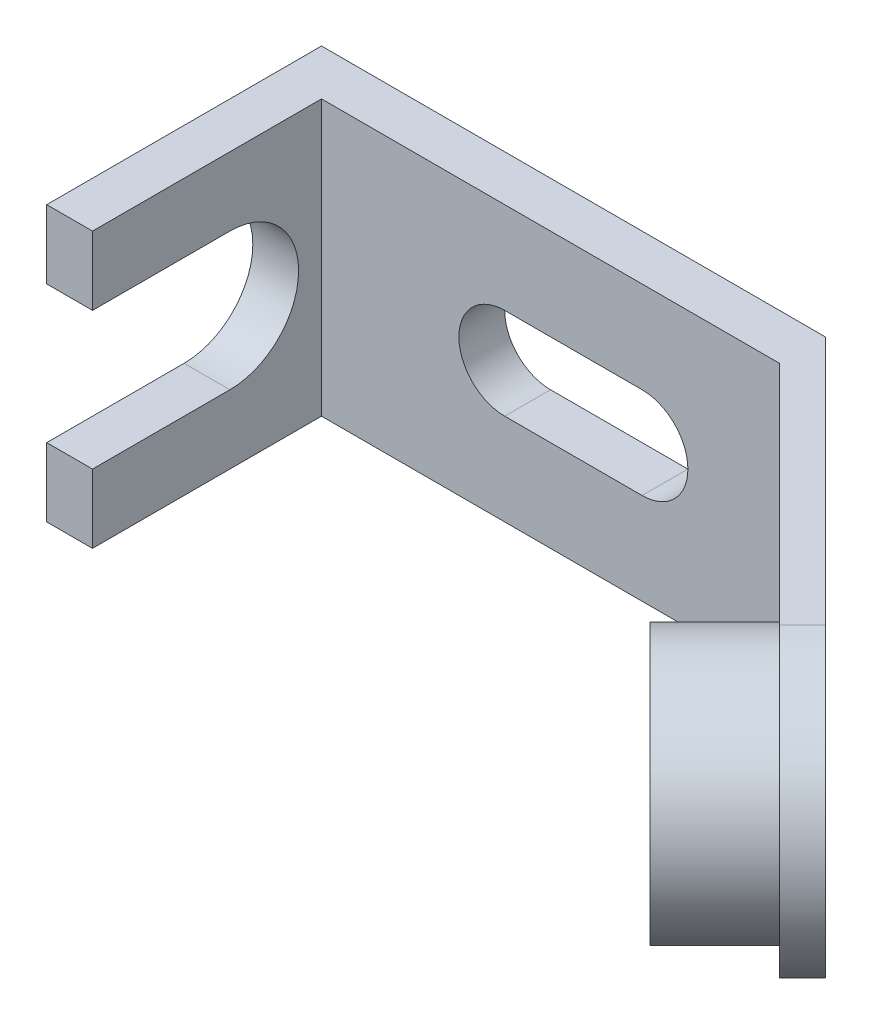
from build123d import *

# Parameters (mm, degrees)
SKETCH1_W           = 100
SKETCH1_H           = 60
BOSS_EXTRUDE1_DEPTH = 10
BOSS_EXTRUDE2_DEPTH = 10
BOSS_EXTRUDE3_DEPTH = 60
SKETCH5_R           = 25
SKETCH5_R_2         = 15
BOSS_EXTRUDE4_DEPTH = 20
CUT_EXTRUDE3_DEPTH  = 20
CUT_EXTRUDE4_START  = -20
SKETCH6_R           = 15
CUT_EXTRUDE4_DEPTH  = 20


with BuildPart() as part:
    # Sketch1 → Boss-Extrude1 (new body)
    with BuildSketch(Plane.XY):
        Rectangle(SKETCH1_W, SKETCH1_H)
        with BuildLine():
            Line((-10, 10), (20, 10))
            ThreePointArc((20, 10), (30, 0), (20, -10))
            Line((20, -10), (-10, -10))
            ThreePointArc((-10, -10), (-20, 0), (-10, 10))
        make_face(mode=Mode.SUBTRACT)
    extrude(amount=BOSS_EXTRUDE1_DEPTH)

    # Sketch3 → Boss-Extrude2 (add)
    with BuildSketch(Plane.ZY.offset(50)):
        with BuildLine():
            Line((0, 30), (60, 30))
            Line((60, 30), (60, 15))
            Line((60, 15), (30, 15))
            ThreePointArc((30, 15), (15, 0), (30, -15))
            Line((30, -15), (60, -15))
            Line((60, -15), (60, -30))
            Line((60, -30), (0, -30))
            Line((0, -30), (0, 30))
        make_face()
    extrude(amount=BOSS_EXTRUDE2_DEPTH)

    # Sketch4 → Boss-Extrude3 (add)
    with BuildSketch(Plane.XZ.offset(30)):
        Polygon((50, 10), (125, 85), (130, 80), (50, 0), align=None)
    extrude(amount=-BOSS_EXTRUDE3_DEPTH)

    # Sketch5 → Boss-Extrude4 (add)
    with BuildSketch(Plane(origin=(20, 0, -20), x_dir=(0.7071067811865462, 0, 0.7071067811865488), z_dir=(-0.7071067811865488, 0, 0.7071067811865462))):
        with Locations((112.426406871, 0)):
            Circle(SKETCH5_R)
        with Locations((112.426406871, 0)):
            Circle(SKETCH5_R_2, mode=Mode.SUBTRACT)
    extrude(amount=BOSS_EXTRUDE4_DEPTH)

    # Sketch5<4> → Cut-Extrude3 (cut)
    with BuildSketch(Plane(origin=(20, 0, -20), x_dir=(0.7071067811865462, 0, 0.7071067811865488), z_dir=(-0.7071067811865488, 0, 0.7071067811865462))):
        with BuildLine():
            Line((112.426406871, -30), (148.492424049, -30))
            Line((148.492424049, -30), (148.492424049, 30))
            Line((148.492424049, 30), (112.426406871, 30))
            ThreePointArc((112.426406871, 30), (142.426406871, 0), (112.426406871, -30))
        make_face()
    extrude(amount=-CUT_EXTRUDE3_DEPTH, mode=Mode.SUBTRACT)

    # Sketch6 → Cut-Extrude4 (cut)
    with BuildSketch(Plane(origin=(20, 0, -20), x_dir=(0.7071067811865464, 0, 0.7071067811865488), z_dir=(-0.7071067811865488, 0, 0.7071067811865464)).offset(CUT_EXTRUDE4_START)):
        with Locations(Location((112.426406871, 0, 0), (0, 0, 180))):
            Circle(SKETCH6_R)
    extrude(amount=CUT_EXTRUDE4_DEPTH, mode=Mode.SUBTRACT)


solid = part.part
